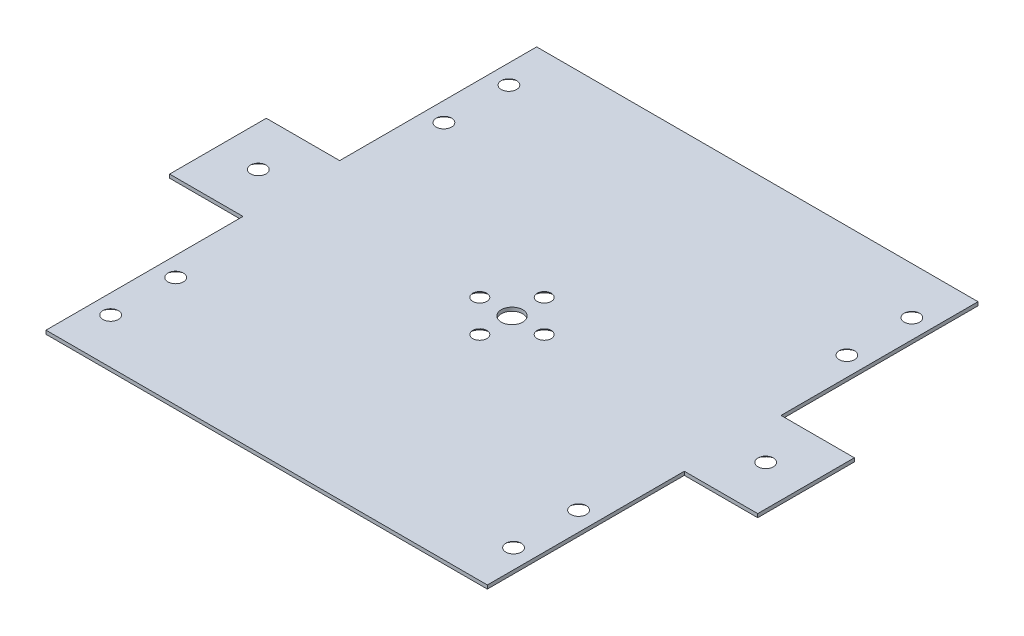
from build123d import *

# Parameters (mm, degrees)
BOSS_EXTRUDE1_DEPTH                            = 1.0668
CSK_FOR_6_FLAT_HEAD_MACHINE_SCREW_2_COUNT      = 2
CSK_FOR_6_FLAT_HEAD_MACHINE_SCREW_2_PITCH      = 117.475
CSK_FOR_6_FLAT_HEAD_MACHINE_SCREW_3_COUNT      = 2
CSK_FOR_6_FLAT_HEAD_MACHINE_SCREW_3_PITCH      = 167.102910264
CSK_FOR_6_FLAT_HEAD_MACHINE_SCREW_4_COUNT      = 2
CSK_FOR_6_FLAT_HEAD_MACHINE_SCREW_4_PITCH      = 118.84025
CSK_FOR_6_FLAT_HEAD_MACHINE_SCREW_5_COUNT      = 2
CSK_FOR_6_FLAT_HEAD_MACHINE_SCREW_5_PITCH      = 120.377583757
CSK_FOR_6_FLAT_HEAD_MACHINE_SCREW_6_COUNT      = 2
CSK_FOR_6_FLAT_HEAD_MACHINE_SCREW_6_PITCH      = 98.298
CSK_FOR_6_FLAT_HEAD_MACHINE_SCREW_7_COUNT      = 2
CSK_FOR_6_FLAT_HEAD_MACHINE_SCREW_7_PITCH      = 154.225495543
CSK_FOR_6_FLAT_HEAD_MACHINE_SCREW_8_COUNT      = 2
CSK_FOR_6_FLAT_HEAD_MACHINE_SCREW_8_PITCH      = 19.177
CSK_FOR_6_FLAT_HEAD_MACHINE_SCREW_9_COUNT      = 2
CSK_FOR_6_FLAT_HEAD_MACHINE_SCREW_9_PITCH      = 60.937464766
CSK_FOR_6_FLAT_HEAD_MACHINE_SCREW_10_COUNT     = 2
CSK_FOR_6_FLAT_HEAD_MACHINE_SCREW_10_PITCH     = 146.616377774
SKETCH4_R                                      = 3.175
CUT_EXTRUDE1_DEPTH                             = 113.951767191
CSK_FOR_M3_FLAT_HEAD_MACHINE_SCREW2_AT_2_COUNT = 2
CSK_FOR_M3_FLAT_HEAD_MACHINE_SCREW2_AT_2_PITCH = 19
CSK_FOR_M3_FLAT_HEAD_MACHINE_SCREW2_AT_3_COUNT = 2
CSK_FOR_M3_FLAT_HEAD_MACHINE_SCREW2_AT_3_PITCH = 13.435028843
CSK_FOR_M3_FLAT_HEAD_MACHINE_SCREW2_AT_4_COUNT = 2
CSK_FOR_M3_FLAT_HEAD_MACHINE_SCREW2_AT_4_PITCH = 13.435028843


with BuildPart() as part:
    # Sketch1 → Boss-Extrude1 (new body)
    with BuildSketch(Plane(origin=(0, 0, 0), x_dir=(1, 0, 0), z_dir=(0, 1, 0))):
        Polygon((-65.0875, 72.35825), (65.0875, 72.35825), (65.0875, 14.25575), (86.725125, 14.25575), (86.725125, -14.25575), (65.0875, -14.25575), (65.0875, -72.35825), (-65.0875, -72.35825), (-65.0875, -14.25575), (-86.725125, -14.25575), (-86.725125, 14.25575), (-65.0875, 14.25575), align=None)
    extrude(amount=BOSS_EXTRUDE1_DEPTH)

    # Sketch2 → CSK for #6 Flat Head Machine Screw (100)1 (revolve, cut)
    with BuildSketch(Plane(origin=(-59.420125, 0, 58.9597584), x_dir=(0, 0, -1), z_dir=(1, 0, 0))):
        Polygon((0, 0), (0, 1.0668), (1.89865, 1.0668), (1.89865, 1.380025208), (3.5433, 0), align=None)
    csk_for_6_flat_head_machine_screw_100 = revolve(axis=Axis((-59.420125, -6.35, 58.9597584), (0, 1, 0)), mode=Mode.SUBTRACT)

    # CSK for _6 Flat Head Machine Screw _ 2: CSK for #6 Flat Head Machine Screw (100)1 ×2
    with Locations(*[(0, 0, -i * CSK_FOR_6_FLAT_HEAD_MACHINE_SCREW_2_PITCH) for i in range(1, CSK_FOR_6_FLAT_HEAD_MACHINE_SCREW_2_COUNT)]):
        add(csk_for_6_flat_head_machine_screw_100, mode=Mode.SUBTRACT)

    # CSK for _6 Flat Head Machine Screw _ 3: CSK for #6 Flat Head Machine Screw (100)1 ×2
    with Locations(*[Vector(0.7111800136357133, 0, -0.7030099488663775) * (i * CSK_FOR_6_FLAT_HEAD_MACHINE_SCREW_3_PITCH) for i in range(1, CSK_FOR_6_FLAT_HEAD_MACHINE_SCREW_3_COUNT)]):
        add(csk_for_6_flat_head_machine_screw_100, mode=Mode.SUBTRACT)

    # CSK for _6 Flat Head Machine Screw _ 4: CSK for #6 Flat Head Machine Screw (100)1 ×2
    with Locations(*[(i * CSK_FOR_6_FLAT_HEAD_MACHINE_SCREW_4_PITCH, 0, 0) for i in range(1, CSK_FOR_6_FLAT_HEAD_MACHINE_SCREW_4_COUNT)]):
        add(csk_for_6_flat_head_machine_screw_100, mode=Mode.SUBTRACT)

    # CSK for _6 Flat Head Machine Screw _ 5: CSK for #6 Flat Head Machine Screw (100)1 ×2
    with Locations(*[Vector(0.9872290694888833, 0, -0.15930713843426378) * (i * CSK_FOR_6_FLAT_HEAD_MACHINE_SCREW_5_PITCH) for i in range(1, CSK_FOR_6_FLAT_HEAD_MACHINE_SCREW_5_COUNT)]):
        add(csk_for_6_flat_head_machine_screw_100, mode=Mode.SUBTRACT)

    # CSK for _6 Flat Head Machine Screw _ 6: CSK for #6 Flat Head Machine Screw (100)1 ×2
    with Locations(*[(0, 0, -i * CSK_FOR_6_FLAT_HEAD_MACHINE_SCREW_6_PITCH) for i in range(1, CSK_FOR_6_FLAT_HEAD_MACHINE_SCREW_6_COUNT)]):
        add(csk_for_6_flat_head_machine_screw_100, mode=Mode.SUBTRACT)

    # CSK for _6 Flat Head Machine Screw _ 7: CSK for #6 Flat Head Machine Screw (100)1 ×2
    with Locations(*[Vector(0.7705616349723654, 0, -0.6373654891102241) * (i * CSK_FOR_6_FLAT_HEAD_MACHINE_SCREW_7_PITCH) for i in range(1, CSK_FOR_6_FLAT_HEAD_MACHINE_SCREW_7_COUNT)]):
        add(csk_for_6_flat_head_machine_screw_100, mode=Mode.SUBTRACT)

    # CSK for _6 Flat Head Machine Screw _ 8: CSK for #6 Flat Head Machine Screw (100)1 ×2
    with Locations(*[(0, 0, -i * CSK_FOR_6_FLAT_HEAD_MACHINE_SCREW_8_PITCH) for i in range(1, CSK_FOR_6_FLAT_HEAD_MACHINE_SCREW_8_COUNT)]):
        add(csk_for_6_flat_head_machine_screw_100, mode=Mode.SUBTRACT)

    # CSK for _6 Flat Head Machine Screw _ 9: CSK for #6 Flat Head Machine Screw (100)1 ×2
    with Locations(*[Vector(-0.2526975820055066, 0, -0.9675453126590869) * (i * CSK_FOR_6_FLAT_HEAD_MACHINE_SCREW_9_PITCH) for i in range(1, CSK_FOR_6_FLAT_HEAD_MACHINE_SCREW_9_COUNT)]):
        add(csk_for_6_flat_head_machine_screw_100, mode=Mode.SUBTRACT)

    # CSK for _6 Flat Head Machine Screw _ 10: CSK for #6 Flat Head Machine Screw (100)1 ×2
    with Locations(*[Vector(0.915579842020543, 0, -0.40213623672287674) * (i * CSK_FOR_6_FLAT_HEAD_MACHINE_SCREW_10_PITCH) for i in range(1, CSK_FOR_6_FLAT_HEAD_MACHINE_SCREW_10_COUNT)]):
        add(csk_for_6_flat_head_machine_screw_100, mode=Mode.SUBTRACT)

    # Sketch4 → Cut-Extrude1 (cut, through all)
    with BuildSketch(Plane.XZ):
        with Locations(Location((0, 0, 0), (0, 0, 270))):
            Circle(SKETCH4_R)
    extrude(amount=-CUT_EXTRUDE1_DEPTH, mode=Mode.SUBTRACT)

    # Sketch5 → CSK for M3 Flat Head Machine Screw2 (revolve, cut)
    with BuildSketch(Plane(origin=(9.5, 0, 0), x_dir=(0, 0, -1), z_dir=(1, 0, 0))):
        Polygon((0, 0), (0, 1.0668), (1.7, 1.0668), (1.7, 1.45), (3.15, 0), align=None)
    csk_for_m3_flat_head_machine_screw2 = revolve(axis=Axis((9.5, -6.35, 0), (0, 1, 0)), mode=Mode.SUBTRACT)

    # CSK for M3 Flat Head Machine Screw2 at 2: CSK for M3 Flat Head Machine Screw2 ×2
    with Locations(*[(-i * CSK_FOR_M3_FLAT_HEAD_MACHINE_SCREW2_AT_2_PITCH, 0, 0) for i in range(1, CSK_FOR_M3_FLAT_HEAD_MACHINE_SCREW2_AT_2_COUNT)]):
        add(csk_for_m3_flat_head_machine_screw2, mode=Mode.SUBTRACT)

    # CSK for M3 Flat Head Machine Screw2 at 3: CSK for M3 Flat Head Machine Screw2 ×2
    with Locations(*[Vector(-0.7071067811865486, 0, -0.7071067811865466) * (i * CSK_FOR_M3_FLAT_HEAD_MACHINE_SCREW2_AT_3_PITCH) for i in range(1, CSK_FOR_M3_FLAT_HEAD_MACHINE_SCREW2_AT_3_COUNT)]):
        add(csk_for_m3_flat_head_machine_screw2, mode=Mode.SUBTRACT)

    # CSK for M3 Flat Head Machine Screw2 at 4: CSK for M3 Flat Head Machine Screw2 ×2
    with Locations(*[Vector(-0.7071067811865486, 0, 0.7071067811865466) * (i * CSK_FOR_M3_FLAT_HEAD_MACHINE_SCREW2_AT_4_PITCH) for i in range(1, CSK_FOR_M3_FLAT_HEAD_MACHINE_SCREW2_AT_4_COUNT)]):
        add(csk_for_m3_flat_head_machine_screw2, mode=Mode.SUBTRACT)


solid = part.part
